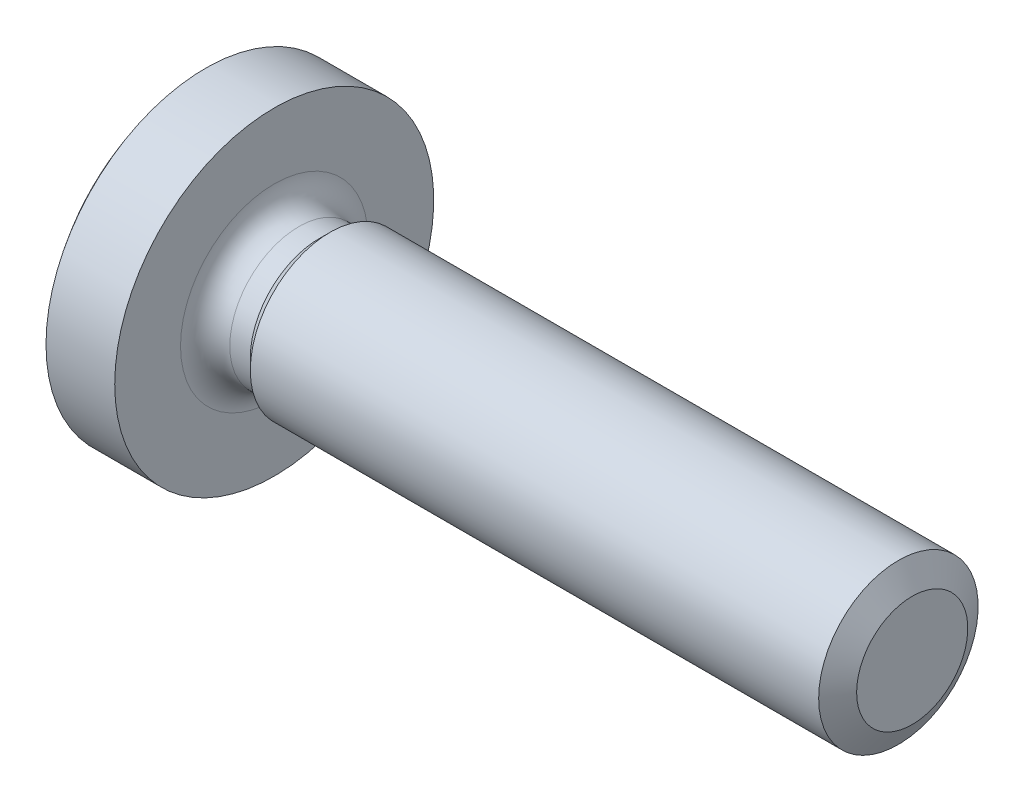
from build123d import *


with BuildPart() as part:
    # 草图2 → Revolve 815 (revolve)
    with BuildSketch(Plane.XY, mode=Mode.PRIVATE) as revolve_815_sk:
        with BuildLine():
            Line((0, 0), (19.1, 0))
            Line((19.1, 0), (19.1, 2))
            Line((19.1, 2), (4.5, 2))
            Line((4.5, 2), (4.232, 1.732))
            Line((4.232, 1.732), (3.718, 1.732))
            ThreePointArc((3.718, 1.732), (3.281008009, 1.913008009), (3.1, 2.35))
            Line((3.1, 2.35), (3.1, 4))
            Line((3.1, 4), (1.376524617, 4))
            ThreePointArc((1.376524617, 4), (0.353757652, 2.115113473), (0, 0))
        make_face()
    revolve(revolve_815_sk.sketch.rotate(Axis((-1.331757704, 0, 0), (1, 0, 0)), 90), axis=Axis((-1.331757704, 0, 0), (1, 0, 0)))

    # 草图3 → 切除-旋转1 (revolve, cut)
    with BuildSketch(Plane.XY, mode=Mode.PRIVATE) as cut_revolve_1_sk:
        Polygon((18.753791204, 2), (19.453791204, 2), (19.1, 1.3938), align=None)
    revolve(cut_revolve_1_sk.sketch.rotate(Axis((-0.242766179, 0, 0), (1, 0, 0)), 90), axis=Axis((-0.242766179, 0, 0), (1, 0, 0)), mode=Mode.SUBTRACT)

    # 草图5 → 切除-放样1 section 0
    with BuildSketch(Plane(origin=(0, 0, 0), x_dir=(0, 0, -1), z_dir=(1, 0, 0)), mode=Mode.PRIVATE) as loft_1_s0:
        with BuildLine():
            Line((0.35, 2.2), (-0.35, 2.2))
            Line((-0.35, 2.2), (-0.35, -2.2))
            Line((-0.35, -2.2), (0.35, -2.2))
            Line((0.35, -2.2), (0.35, 2.2))
        make_face()
    loft_1 = loft([Vertex(2.4, 0, 0), loft_1_s0.sketch], mode=Mode.SUBTRACT)

    # 镜向1: 切除-放样1 across plane
    add(loft_1.mirror(Plane(origin=(0, 0, 0), x_dir=(0, 0.7071067811865462, 0.7071067811865488), z_dir=(0, -0.7071067811865488, 0.7071067811865462))), mode=Mode.SUBTRACT)


solid = part.part
